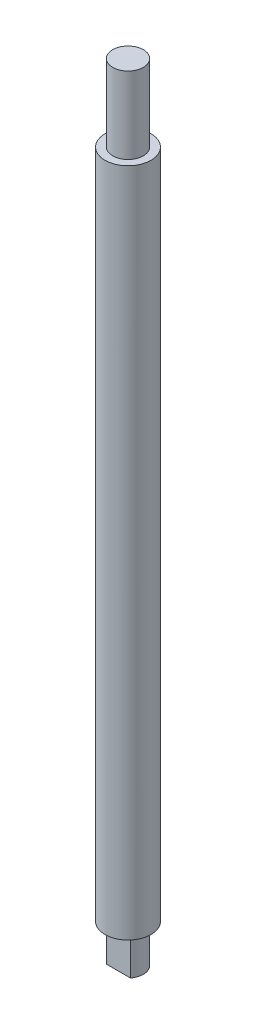
from build123d import *

# Parameters (mm, degrees)
SKETCH_1_R          = 6
EXTRUDE_1_DEPTH     = 185
SKETCH_2_R          = 4
EXTRUDE_2_DEPTH     = 20
SKETCH_3_R          = 9.732435518
SKETCH_3_R_2        = 4
CUT_EXTRUDE_1_DEPTH = 10
CUT_EXTRUDE_2_DEPTH = 10


with BuildPart() as part:
    # Эскиз1 → Бобышка-Вытянуть1 (new body)
    with BuildSketch(Plane(origin=(0, 0, 0), x_dir=(1, 0, 0), z_dir=(0, 1, 0))):
        with Locations(Location((0, 0, 0), (0, 0, 270))):
            Circle(SKETCH_1_R)
    extrude(amount=EXTRUDE_1_DEPTH)

    # Эскиз2 → Бобышка-Вытянуть2 (add)
    with BuildSketch(Plane(origin=(0, 185, 0), x_dir=(1, 0, 0), z_dir=(0, 1, 0))):
        with Locations(Location((0, 0, 0), (0, 0, 270))):
            Circle(SKETCH_2_R)
    extrude(amount=EXTRUDE_2_DEPTH)

    # Эскиз3 → Вырез-Вытянуть1 (cut)
    with BuildSketch(Plane.XZ):
        Circle(SKETCH_3_R)
        with Locations(Location((0, 0, 0), (0, 0, 90))):
            Circle(SKETCH_3_R_2, mode=Mode.SUBTRACT)
    extrude(amount=-CUT_EXTRUDE_1_DEPTH, mode=Mode.SUBTRACT)

    # Эскиз4 → Вырез-Вытянуть2 (cut)
    with BuildSketch(Plane.XZ):
        Polygon((-4.486362363, 2.5), (4.2655411, 2.5), (0, 5.300115958), align=None)
    extrude(amount=-CUT_EXTRUDE_2_DEPTH, mode=Mode.SUBTRACT)


solid = part.part
